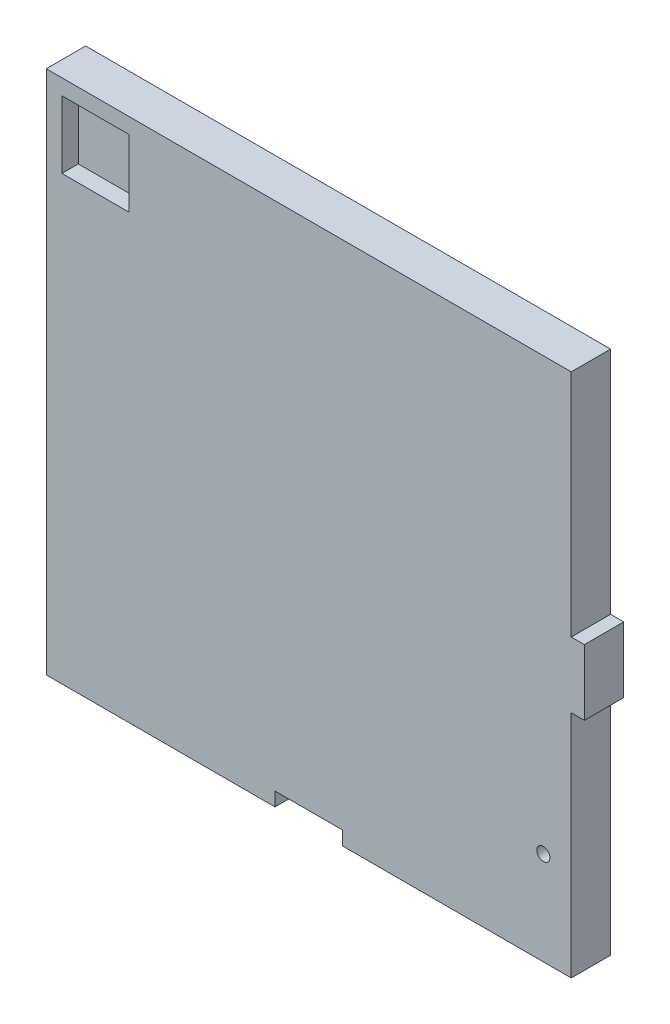
from build123d import *

# Parameters (mm, degrees)
SKETCH1_R           = 2
BOSS_EXTRUDE1_DEPTH = 12
SKETCH2_W           = 20.5
SKETCH2_H           = 20.5
CUT_EXTRUDE1_DEPTH  = 5
SKETCH4_R           = 3.45
CUT_EXTRUDE2_DEPTH  = 8


with BuildPart() as part:
    # Sketch1 → Boss-Extrude1 (new body)
    with BuildSketch(Plane.XY):
        Polygon((0, 0), (69.7, 0), (69.7, 4.2), (90.3, 4.2), (90.3, 0), (160, 0), (160, 70), (164, 70), (164, 90), (160, 90), (160, 160), (90, 160), (70, 160), (0, 160), (0, 90.3), (0, 69.7), align=None)
        with Locations((151.5, 28.5)):
            Circle(SKETCH1_R, mode=Mode.SUBTRACT)
    extrude(amount=BOSS_EXTRUDE1_DEPTH)

    # Sketch2 → Cut-Extrude1 (cut)
    with BuildSketch(Plane.XY.offset(12)):
        with Locations((15, 145)):
            Rectangle(SKETCH2_W, SKETCH2_H)
    extrude(amount=-CUT_EXTRUDE1_DEPTH, mode=Mode.SUBTRACT)

    # Sketch4 → Cut-Extrude2 (cut)
    with BuildSketch(Plane(origin=(0, 0, 0), x_dir=(-1, 0, 0), z_dir=(0, 0, -1))):
        with Locations((-151.5, 28.5)):
            Circle(SKETCH4_R)
    extrude(amount=-CUT_EXTRUDE2_DEPTH, mode=Mode.SUBTRACT)


solid = part.part
